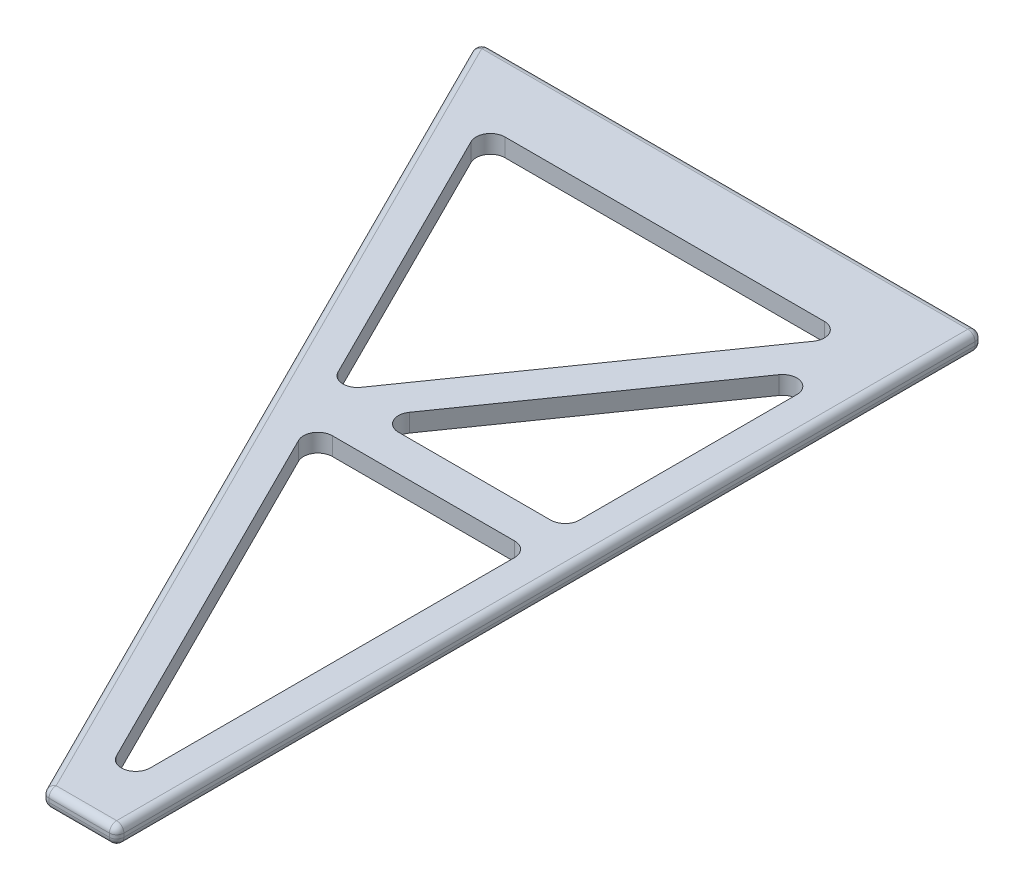
from build123d import *

# Parameters (mm, degrees)
SKETCH1_W           = 254
SKETCH1_H           = 6.35
BOSS_EXTRUDE1_DEPTH = 304.8
CUT_EXTRUDE1_DEPTH  = 304.8
CUT_EXTRUDE2_DEPTH  = 397.811494919
CUT_EXTRUDE3_REACH  = 398.811
FILLET2_R           = 2.54


with BuildPart() as part:
    # Sketch1 → Boss-Extrude1 (new body)
    with BuildSketch(Plane.XY):
        with Locations((-127, 3.175)):
            Rectangle(SKETCH1_W, SKETCH1_H)
    extrude(amount=BOSS_EXTRUDE1_DEPTH)

    # Sketch2 → Cut-Extrude1 (cut)
    with BuildSketch(Plane(origin=(0, 6.35, 0), x_dir=(1, 0, 0), z_dir=(0, 1, 0))):
        Polygon((-101.6, -304.8), (-254, 0), (-254, -304.8), align=None)
    extrude(amount=-CUT_EXTRUDE1_DEPTH, mode=Mode.SUBTRACT)

    # Sketch4 → Cut-Extrude2 (cut, through all)
    with BuildSketch(Plane(origin=(0, 6.35, 0), x_dir=(1, 0, 0), z_dir=(0, 1, 0))):
        Polygon((-76.2, -127), (-76.2, 0), (0, 0), (0, -304.8), (-76.2, -304.8), (-76.2, -177.8), align=None)
    extrude(amount=-CUT_EXTRUDE2_DEPTH, mode=Mode.SUBTRACT)

    # Sketch9 → Cut-Extrude3 (cut, up to next)
    with BuildSketch(Plane(origin=(0, 6.35, 0), x_dir=(1, 0, 0), z_dir=(0, 1, 0)), mode=Mode.PRIVATE) as cut_extrude3_sk1:
        with BuildLine():
            Line((-102.249215459, -33.393768297), (-167.865313489, -127.103267909))
            ThreePointArc((-167.865313489, -127.103267909), (-172.400201066, -129.255743451), (-176.570296004, -126.461344677))
            Line((-176.570296004, -126.461344677), (-223.42504581, -32.751845065))
            ThreePointArc((-223.42504581, -32.751845065), (-223.202661786, -27.80928595), (-218.88135568, -25.4))
            Line((-218.88135568, -25.4), (-106.410507844, -25.4))
            ThreePointArc((-106.410507844, -25.4), (-101.904492811, -28.134317045), (-102.249215459, -33.393768297))
        make_face()
    cut_extrude3_tool1 = extrude(cut_extrude3_sk1.sketch, amount=-CUT_EXTRUDE3_REACH, mode=Mode.PRIVATE) & part.part
    # Sketch9 → Cut-Extrude3 (cut, up to next)
    with BuildSketch(Plane(origin=(0, 6.35, 0), x_dir=(1, 0, 0), z_dir=(0, 1, 0)), mode=Mode.PRIVATE) as cut_extrude3_sk2:
        with BuildLine():
            Line((-158.13257617, -146.897559021), (-93.98, -146.897559021))
            ThreePointArc((-93.98, -146.897559021), (-90.387897552, -148.385456572), (-88.9, -151.977559021))
            Line((-88.9, -151.977559021), (-88.9, -280.28271136))
            ThreePointArc((-88.9, -280.28271136), (-92.812855164, -285.226816227), (-98.52369013, -282.554556425))
            Line((-98.52369013, -282.554556425), (-162.6762663, -154.249404086))
            ThreePointArc((-162.6762663, -154.249404086), (-162.453882276, -149.306844971), (-158.13257617, -146.897559021))
        make_face()
    cut_extrude3_tool2 = extrude(cut_extrude3_sk2.sketch, amount=-CUT_EXTRUDE3_REACH, mode=Mode.PRIVATE) & part.part
    # Sketch9 → Cut-Extrude3 (cut, up to next)
    with BuildSketch(Plane(origin=(0, 6.35, 0), x_dir=(1, 0, 0), z_dir=(0, 1, 0)), mode=Mode.PRIVATE) as cut_extrude3_sk3:
        with BuildLine():
            Line((-98.141292385, -49.668820452), (-151.731655506, -126.203790724))
            ThreePointArc((-151.731655506, -126.203790724), (-152.076378154, -131.463241976), (-147.570363121, -134.197559021))
            Line((-147.570363121, -134.197559021), (-93.98, -134.197559021))
            ThreePointArc((-93.98, -134.197559021), (-90.387897552, -132.709661469), (-88.9, -129.117559021))
            Line((-88.9, -129.117559021), (-88.9, -52.582588748))
            ThreePointArc((-88.9, -52.582588748), (-92.452414539, -47.737706638), (-98.141292385, -49.668820452))
        make_face()
    cut_extrude3_tool3 = extrude(cut_extrude3_sk3.sketch, amount=-CUT_EXTRUDE3_REACH, mode=Mode.PRIVATE) & part.part
    add(cut_extrude3_tool1.solids().sort_by_distance((-165.555188, 6.35, 61.646702))[0], mode=Mode.SUBTRACT)
    add(cut_extrude3_tool2.solids().sort_by_distance((-114.904844, 6.35, 197.54946))[0], mode=Mode.SUBTRACT)
    add(cut_extrude3_tool3.solids().sort_by_distance((-111.777944, 6.35, 102.228886))[0], mode=Mode.SUBTRACT)

    # Fillet2
    fillet2_edges = [part.edges().sort_by_distance(p)[0] for p in [
        (-177.8, 0, 152.4),
        (-177.8, 6.35, 152.4),
        (-101.6, 3.175, 304.8),
        (-165.1, 0, 0),
        (-165.1, 6.35, 0),
        (-88.9, 6.35, 304.8),
        (-88.9, 0, 304.8),
        (-76.2, 6.35, 152.4),
        (-76.2, 3.175, 304.8),
        (-76.2, 3.175, 0),
        (-76.2, 0, 152.4),
        (-254, 3.175, 0),
    ]]
    fillet(fillet2_edges, radius=FILLET2_R)


solid = part.part
